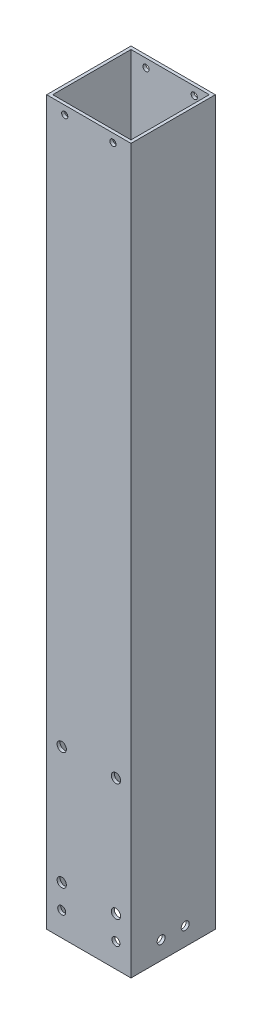
from build123d import *

# Parameters (mm, degrees)
SKETCH1_W                      = 88.9
SKETCH1_H                      = 88.9
SKETCH1_W_2                    = 82.55
SKETCH1_H_2                    = 82.55
BOSS_EXTRUDE1_DEPTH            = 762
CUT_EXTRUDE1_DEPTH             = 765.588520055
CUT_EXTRUDE1_DEPTH_BACK        = 765.588520055
SKETCH2_R                      = 4.2164
CUT_EXTRUDE2_DEPTH             = 769.45495151
CUT_EXTRUDE2_DEPTH_BACK        = 769.45495151
SKETCH3_R                      = 8.1915
SKETCH3_R_2                    = 4.2164
CUT_EXTRUDE3_REACH             = 770.455
SKETCH4_R                      = 8.1915
CUT_EXTRUDE3_DIRECTION_2_DEPTH = 769.45495151
F_3_8_CLEARANCE_HOLE2_D        = 9.8044
SKETCH10_R                     = 7.9375
CUT_EXTRUDE4_DEPTH             = 8.128
F_1_4_CLEARANCE_HOLE1_D        = 6.5278


with BuildPart() as part:
    # Sketch1 → Boss-Extrude1 (new body)
    with BuildSketch(Plane(origin=(0, 0, 0), x_dir=(1, 0, 0), z_dir=(0, 1, 0))):
        Rectangle(SKETCH1_W, SKETCH1_H)
        Rectangle(SKETCH1_W_2, SKETCH1_H_2, mode=Mode.SUBTRACT)
    extrude(amount=BOSS_EXTRUDE1_DEPTH)

    # Sketch2 → Cut-Extrude1 (cut, two sides: drawn at the far end of the back side and taken through both)
    with BuildSketch(Plane.XY.offset(-CUT_EXTRUDE1_DEPTH_BACK)):
        with Locations((-28.575, 25.4)):
            Circle(SKETCH2_R)
        with Locations((28.575, 25.4)):
            Circle(SKETCH2_R)
    extrude(amount=CUT_EXTRUDE1_DEPTH + CUT_EXTRUDE1_DEPTH_BACK, mode=Mode.SUBTRACT)

    # Sketch3 → Cut-Extrude2 (cut, two sides: drawn at the far end of the back side and taken through both)
    with BuildSketch(Plane.ZY.offset(44.45).offset(-CUT_EXTRUDE2_DEPTH_BACK)):
        with Locations((0, -13.00951767)):
            Circle(SKETCH3_R)
        with Locations((12.7, 19.05)):
            Circle(SKETCH3_R_2)
        with Locations((-12.7, 19.05)):
            Circle(SKETCH3_R_2)
    extrude(amount=CUT_EXTRUDE2_DEPTH + CUT_EXTRUDE2_DEPTH_BACK, mode=Mode.SUBTRACT)

    # Sketch4 → Cut-Extrude3 (cut, up to next)
    with BuildSketch(Plane(origin=(0, 0, -44.45), x_dir=(-1, 0, 0), z_dir=(0, 0, -1)), mode=Mode.PRIVATE) as cut_extrude3_sk1:
        with Locations((0, -2.54)):
            Circle(SKETCH4_R)
    cut_extrude3_tool1 = extrude(cut_extrude3_sk1.sketch, amount=-CUT_EXTRUDE3_REACH, mode=Mode.PRIVATE) & part.part
    add(cut_extrude3_tool1.solids().sort_by_distance((0, -2.54, -44.45))[0], mode=Mode.SUBTRACT)

    # Sketch4 → Cut-Extrude3 direction 2 (cut)
    with BuildSketch(Plane(origin=(0, 0, -44.45), x_dir=(-1, 0, 0), z_dir=(0, 0, -1))):
        with Locations((0, -2.54)):
            Circle(SKETCH4_R)
    extrude(amount=CUT_EXTRUDE3_DIRECTION_2_DEPTH, mode=Mode.SUBTRACT)

    # 3/8 Clearance Hole2 (through all)
    with Locations(Plane(origin=(28.575, 50.8, -44.45), x_dir=(-1, 0, 0), z_dir=(0, 0, -1))):
        with Locations((0, 0), (57.15, 0), (57.15, 123.825), (0, 123.825)):
            Hole(F_3_8_CLEARANCE_HOLE2_D / 2)

    # Sketch10 → Cut-Extrude4 (cut)
    with BuildSketch(Plane(origin=(0, 0, -44.45), x_dir=(-1, 0, 0), z_dir=(0, 0, -1))):
        with Locations((0, 383.9845)):
            Circle(SKETCH10_R)
    extrude(amount=-CUT_EXTRUDE4_DEPTH, mode=Mode.SUBTRACT)

    # 1/4 Clearance Hole1 (through all)
    with Locations(Plane(origin=(0, 0, -44.45), x_dir=(-1, 0, 0), z_dir=(0, 0, -1))):
        with Locations((25.4, 753.11), (-25.4, 753.11)):
            Hole(F_1_4_CLEARANCE_HOLE1_D / 2)


solid = part.part
